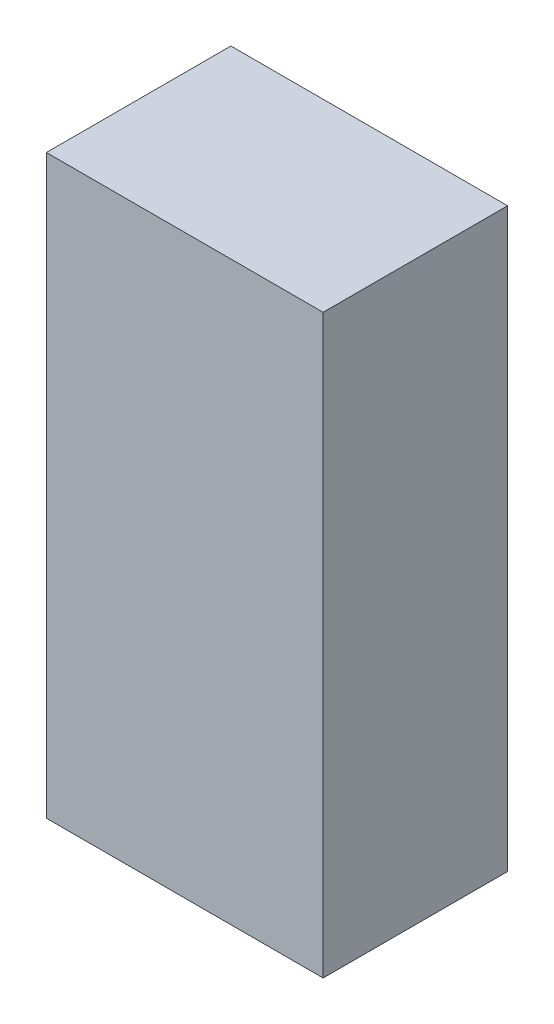
from build123d import *

# Parameters (mm, degrees)
SKETCH1_W      = 12
SKETCH1_H      = 25
ENVELOPE_DEPTH = 8


with BuildPart() as part:
    # Sketch1 → Envelope (new body)
    with BuildSketch(Plane.XY):
        Rectangle(SKETCH1_W, SKETCH1_H)
    extrude(amount=ENVELOPE_DEPTH)


solid = part.part
